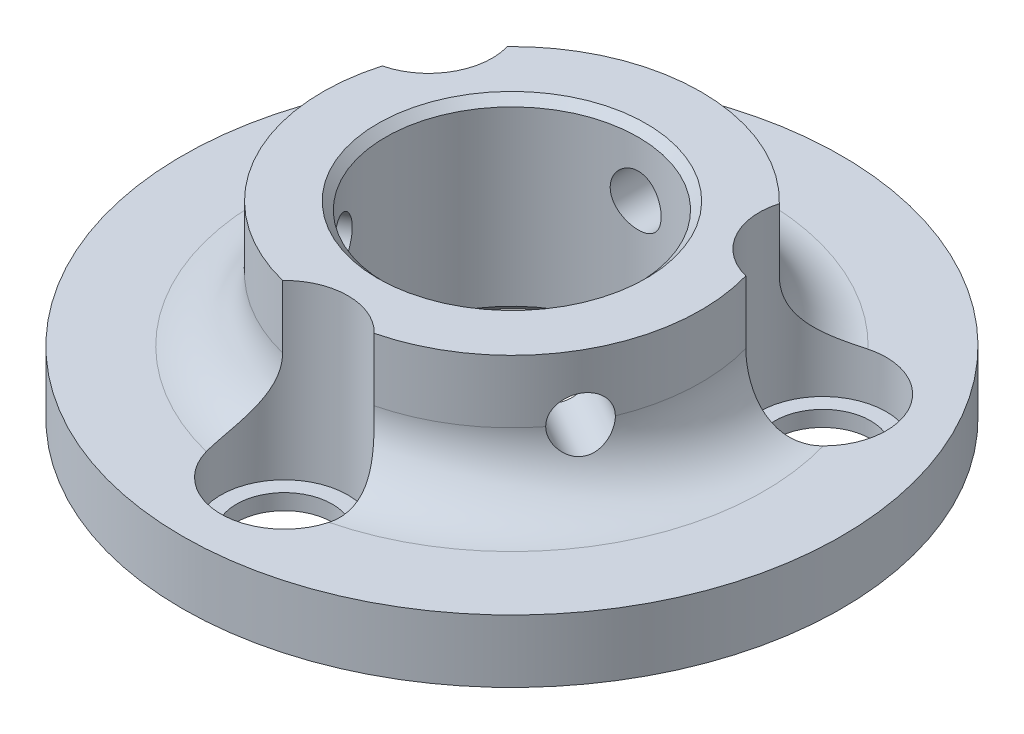
from build123d import *

# Parameters (mm, degrees)
CROQUIS2_R                        = 21
CROQUIS2_R_2                      = 8.05
SALIENTE_EXTRUIR1_DEPTH           = 4
CROQUIS3_R                        = 12.05
CROQUIS3_R_2                      = 8.05
SALIENTE_EXTRUIR2_DEPTH           = 8
REDONDEO1_R                       = 4
CORTAR_EXTRUIR2_REACH             = 34.031
CROQUIS5_R                        = 4.05
CROQUIS4_R                        = 1.625
CORTAR_EXTRUIR3_DEPTH             = 33.031234794
CORTAR_EXTRUIR4_REACH             = 41.705
CROQUIS6_R                        = 1.625
CORTAR_EXTRUIR4_DIRECTION_2_REACH = 41.705
CROQUIS7_R                        = 4.05
CROQUIS7_R_2                      = 3.05
SALIENTE_EXTRUIR3_DEPTH           = 1
CHAFL_N1_SIZE                     = 0.5
CORTAR_EXTRUIR5_REACH             = 41.705
CROQUIS8_R                        = 1.625
CORTAR_EXTRUIR5_DIRECTION_2_REACH = 41.705


with BuildPart() as part:
    # Croquis2 → Saliente-Extruir1 (new body)
    with BuildSketch(Plane(origin=(0, 0, 0), x_dir=(1, 0, 0), z_dir=(0, 1, 0))):
        with Locations(Location((0, 0, 0), (0, 0, 270))):
            Circle(CROQUIS2_R)
        with Locations(Location((0, 0, 0), (0, 0, 270))):
            Circle(CROQUIS2_R_2, mode=Mode.SUBTRACT)
    extrude(amount=SALIENTE_EXTRUIR1_DEPTH)

    # Croquis3 → Saliente-Extruir2 (add)
    with BuildSketch(Plane(origin=(0, 4, 0), x_dir=(1, 0, 0), z_dir=(0, 1, 0))):
        with Locations(Location((0, 0, 0), (0, 0, 270))):
            Circle(CROQUIS3_R)
        with Locations(Location((0, 0, 0), (0, 0, 270))):
            Circle(CROQUIS3_R_2, mode=Mode.SUBTRACT)
    extrude(amount=SALIENTE_EXTRUIR2_DEPTH)

    # Redondeo1
    redondeo1_edges = [part.edges().sort_by_distance(p)[0] for p in [
        (0, 4, -12.05),
    ]]
    fillet(redondeo1_edges, radius=REDONDEO1_R)

    # Croquis5 → Cortar-Extruir2 (cut, up to next)
    with BuildSketch(Plane.XZ, mode=Mode.PRIVATE) as cortar_extruir2_sk1:
        with Locations(Location((0, 14.5, 0), (0, 0, 270))):
            Circle(CROQUIS5_R)
    cortar_extruir2_tool1 = extrude(cortar_extruir2_sk1.sketch, amount=-CORTAR_EXTRUIR2_REACH, mode=Mode.PRIVATE) & part.part
    # Croquis5 → Cortar-Extruir2 (cut, up to next)
    with BuildSketch(Plane.XZ, mode=Mode.PRIVATE) as cortar_extruir2_sk2:
        with Locations(Location((12.557368355, -7.25, 0), (0, 0, 270))):
            Circle(CROQUIS5_R)
    cortar_extruir2_tool2 = extrude(cortar_extruir2_sk2.sketch, amount=-CORTAR_EXTRUIR2_REACH, mode=Mode.PRIVATE) & part.part
    # Croquis5 → Cortar-Extruir2 (cut, up to next)
    with BuildSketch(Plane.XZ, mode=Mode.PRIVATE) as cortar_extruir2_sk3:
        with Locations(Location((-12.557368355, -7.25, 0), (0, 0, 270))):
            Circle(CROQUIS5_R)
    cortar_extruir2_tool3 = extrude(cortar_extruir2_sk3.sketch, amount=-CORTAR_EXTRUIR2_REACH, mode=Mode.PRIVATE) & part.part
    add(cortar_extruir2_tool1.solids().sort_by_distance((0, 0, 14.5))[0], mode=Mode.SUBTRACT)
    add(cortar_extruir2_tool2.solids().sort_by_distance((12.557368, 0, -7.25))[0], mode=Mode.SUBTRACT)
    add(cortar_extruir2_tool3.solids().sort_by_distance((-12.557368, 0, -7.25))[0], mode=Mode.SUBTRACT)

    # Croquis4 → Cortar-Extruir3 (cut, through all)
    with BuildSketch(Plane.XY):
        with Locations((0, 8)):
            Circle(CROQUIS4_R)
    extrude(amount=-CORTAR_EXTRUIR3_DEPTH, mode=Mode.SUBTRACT)

    # Croquis6 → Cortar-Extruir4 (cut, up to next)
    with BuildSketch(Plane(origin=(7.250941954, 0, 4.186333289), x_dir=(-0.5000000000000033, 0, 0.8660254037844367), z_dir=(-0.8660254037844367, 0, -0.5000000000000033)), mode=Mode.PRIVATE) as cortar_extruir4_sk1:
        with Locations(Location((0, 8, 0), (0, 0, 180))):
            Circle(CROQUIS6_R)
    cortar_extruir4_tool1 = extrude(cortar_extruir4_sk1.sketch, amount=-CORTAR_EXTRUIR4_REACH, mode=Mode.PRIVATE) & part.part
    add(cortar_extruir4_tool1.solids().sort_by_distance((7.250942, 8, 4.186333))[0], mode=Mode.SUBTRACT)

    # Croquis6 → Cortar-Extruir4 direction 2 (cut, up to next)
    with BuildSketch(Plane(origin=(7.250941954, 0, 4.186333289), x_dir=(-0.5000000000000033, 0, 0.8660254037844367), z_dir=(-0.8660254037844367, 0, -0.5000000000000033)), mode=Mode.PRIVATE) as cortar_extruir4_direction_2_sk1:
        with Locations(Location((0, 8, 0), (0, 0, 180))):
            Circle(CROQUIS6_R)
    cortar_extruir4_direction_2_tool1 = extrude(cortar_extruir4_direction_2_sk1.sketch, amount=CORTAR_EXTRUIR4_DIRECTION_2_REACH, mode=Mode.PRIVATE) & part.part
    add(cortar_extruir4_direction_2_tool1.solids().sort_by_distance((7.250942, 8, 4.186333))[0], mode=Mode.SUBTRACT)

    # Croquis7 → Saliente-Extruir3 (add)
    # profile 1 of 3: a face of its own
    with BuildSketch(Plane.XZ):
        with Locations(Location((0, 14.5, 0), (0, 0, 270))):
            Circle(CROQUIS7_R)
        with Locations(Location((0, 14.5, 0), (0, 0, 270))):
            Circle(CROQUIS7_R_2, mode=Mode.SUBTRACT)
    # profile 2 of 3: a face of its own
    with BuildSketch(Plane.XZ):
        with Locations(Location((12.557368355, -7.25, 0), (0, 0, 270))):
            Circle(CROQUIS7_R)
        with Locations(Location((12.557368355, -7.25, 0), (0, 0, 270))):
            Circle(CROQUIS7_R_2, mode=Mode.SUBTRACT)
    # profile 3 of 3: a face of its own
    with BuildSketch(Plane.XZ):
        with Locations(Location((-12.557368355, -7.25, 0), (0, 0, 270))):
            Circle(CROQUIS7_R)
        with Locations(Location((-12.557368355, -7.25, 0), (0, 0, 270))):
            Circle(CROQUIS7_R_2, mode=Mode.SUBTRACT)
    extrude(amount=-SALIENTE_EXTRUIR3_DEPTH)

    # Chaflán1
    chafl_n1_edges = [part.edges().sort_by_distance(p)[0] for p in [
        (0, 12, -8.05),
        (0, 0, -8.05),
    ]]
    chamfer(chafl_n1_edges, length=CHAFL_N1_SIZE)

    # Croquis8 → Cortar-Extruir5 (cut, up to next)
    with BuildSketch(Plane(origin=(-7.250941954, 0, 4.186333289), x_dir=(-0.5000000000000002, 0, -0.8660254037844386), z_dir=(0.8660254037844386, 0, -0.5000000000000002)), mode=Mode.PRIVATE) as cortar_extruir5_sk1:
        with Locations(Location((0, 8, 0), (0, 0, 180))):
            Circle(CROQUIS8_R)
    cortar_extruir5_tool1 = extrude(cortar_extruir5_sk1.sketch, amount=-CORTAR_EXTRUIR5_REACH, mode=Mode.PRIVATE) & part.part
    add(cortar_extruir5_tool1.solids().sort_by_distance((-7.250942, 8, 4.186333))[0], mode=Mode.SUBTRACT)

    # Croquis8 → Cortar-Extruir5 direction 2 (cut, up to next)
    with BuildSketch(Plane(origin=(-7.250941954, 0, 4.186333289), x_dir=(-0.5000000000000002, 0, -0.8660254037844386), z_dir=(0.8660254037844386, 0, -0.5000000000000002)), mode=Mode.PRIVATE) as cortar_extruir5_direction_2_sk1:
        with Locations(Location((0, 8, 0), (0, 0, 180))):
            Circle(CROQUIS8_R)
    cortar_extruir5_direction_2_tool1 = extrude(cortar_extruir5_direction_2_sk1.sketch, amount=CORTAR_EXTRUIR5_DIRECTION_2_REACH, mode=Mode.PRIVATE) & part.part
    add(cortar_extruir5_direction_2_tool1.solids().sort_by_distance((-7.250942, 8, 4.186333))[0], mode=Mode.SUBTRACT)


solid = part.part
